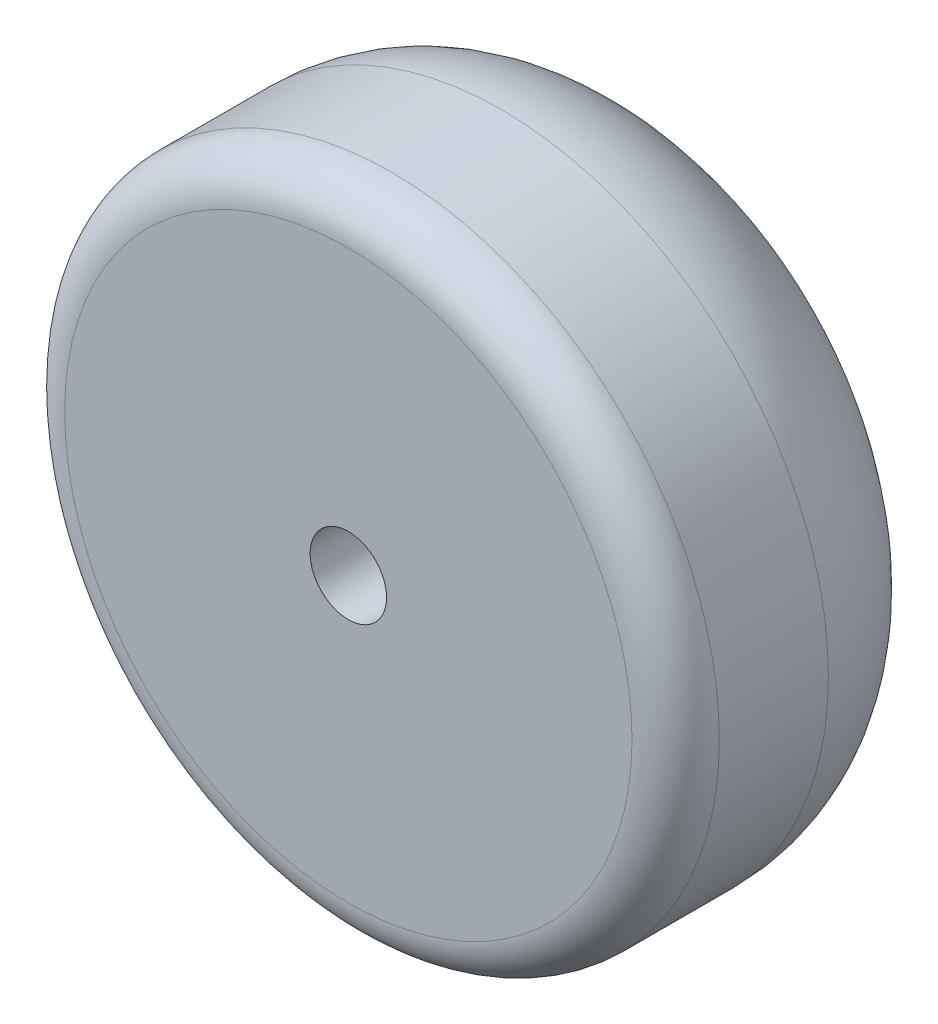
from build123d import *

# Parameters (mm, degrees)
SKETCH_1_R      = 15
SKETCH_1_R_2    = 1.75
EXTRUDE_1_DEPTH = 14
FILLET_1_R      = 2
FILLET_2_R      = 7


with BuildPart() as part:
    # Эскиз1 → Бобышка-Вытянуть1 (new body)
    with BuildSketch(Plane.XY):
        Circle(SKETCH_1_R)
        Circle(SKETCH_1_R_2, mode=Mode.SUBTRACT)
    extrude(amount=EXTRUDE_1_DEPTH)

    # Скругление1
    fillet_1_edges = [part.edges().sort_by_distance(p)[0] for p in [
        (-15, 0, 14),
    ]]
    fillet(fillet_1_edges, radius=FILLET_1_R)

    # Скругление2
    fillet_2_edges = [part.edges().sort_by_distance(p)[0] for p in [
        (-15, 0, 0),
    ]]
    fillet(fillet_2_edges, radius=FILLET_2_R)


solid = part.part
